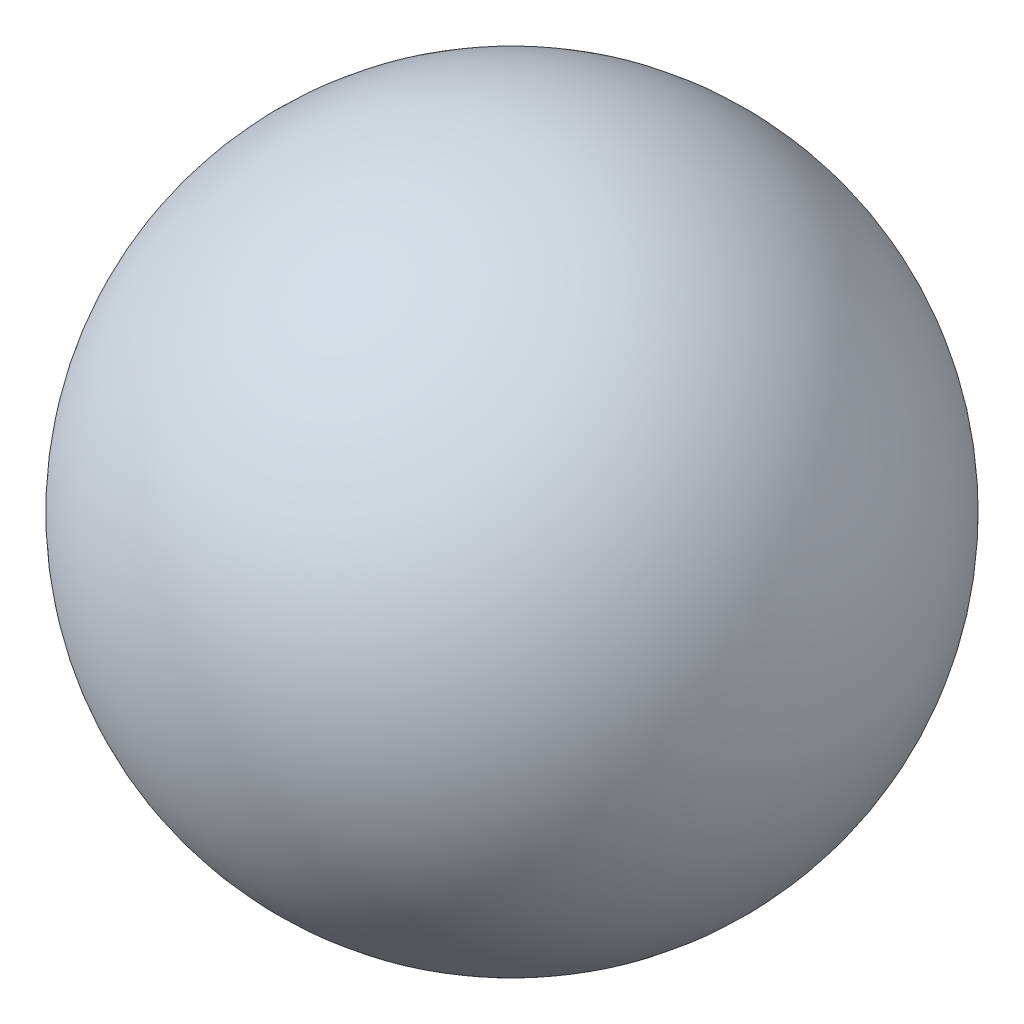
from build123d import *


with BuildPart() as part:
    # Sketch2 → Revolve1 (revolve)
    with BuildSketch(Plane.XY):
        with BuildLine():
            Line((0, 0), (0, 19.05))
            ThreePointArc((0, 19.05), (9.525, 9.525), (0, 0))
        make_face()
    revolve(axis=Axis((0, 0, 0), (0, 1, 0)))


solid = part.part
